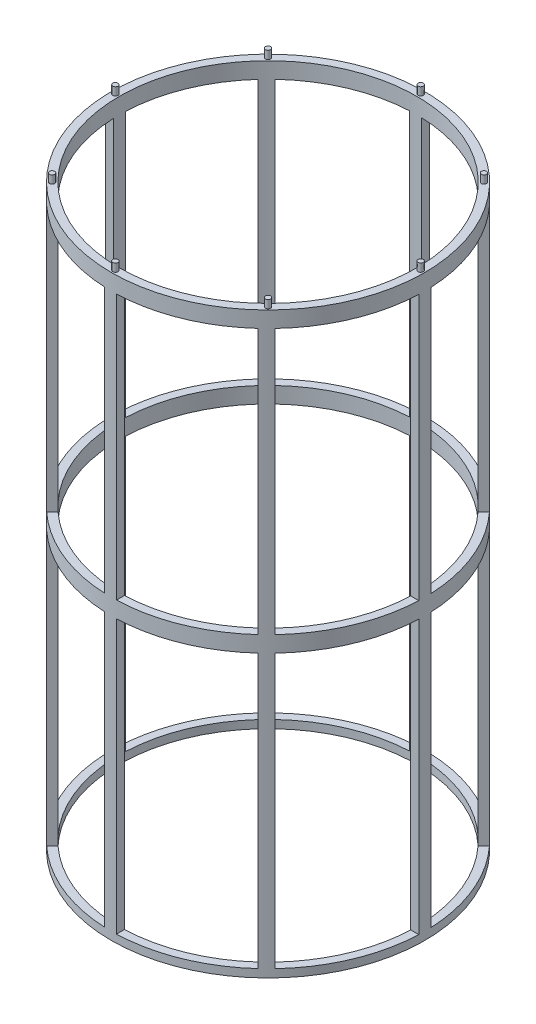
from build123d import *

# Parameters (mm, degrees)
SKETCH1_R               = 49.53
SKETCH1_R_2             = 46.99
BOSS_EXTRUDE1_DEPTH     = 182.88
CUT_EXTRUDE1_DEPTH      = 177.8
SKETCH3_R               = 49.53
SKETCH3_R_2             = 46.99
BOSS_EXTRUDE2_DEPTH     = 2.54
SKETCH4_R               = 49.53
SKETCH4_R_2             = 46.99
BOSS_EXTRUDE3_DEPTH     = 2.54
BOSS_EXTRUDE4_START     = -5.08
SKETCH5_R               = 49.53
BOSS_EXTRUDE4_DEPTH     = 5.08
SKETCH6_W               = 50.419
SKETCH6_H               = 4.699
BOSS_EXTRUDE5_DEPTH     = 2.54
SKETCH7_R               = 0.8255
BOSS_EXTRUDE6_DEPTH     = 2.54
CIRPATTERN2_COUNT       = 8
CUT_EXTRUDE2_DEPTH      = 199.209531052
CUT_EXTRUDE2_DEPTH_BACK = 199.209531052
SKETCH8_W               = 132.398464635
SKETCH8_H               = 191.049097361


with BuildPart() as part:
    # Sketch1 → Boss-Extrude1 (new, symmetric)
    with BuildSketch(Plane(origin=(0, 0, 0), x_dir=(1, 0, 0), z_dir=(0, 1, 0))):
        with Locations(Location((0, 0, 0), (0, 0, 270))):
            Circle(SKETCH1_R)
        with Locations(Location((0, 0, 0), (0, 0, 270))):
            Circle(SKETCH1_R_2, mode=Mode.SUBTRACT)
    extrude(amount=BOSS_EXTRUDE1_DEPTH, both=True)

    # Sketch2 → Cut-Extrude1 (cut, symmetric)
    with BuildSketch(Plane(origin=(0, 0, 0), x_dir=(1, 0, 0), z_dir=(0, 1, 0))):
        with BuildLine():
            Line((34.339077963, -32.07628134), (36.13611782, -33.873321197))
            ThreePointArc((36.13611782, -33.873321197), (45.710930003, -19.071753413), (49.49527883, -1.854258207))
            Line((49.49527883, -1.854258207), (46.953400585, -1.854258207))
            ThreePointArc((46.953400585, -1.854258207), (43.364264524, -18.099742051), (34.339077963, -32.07628134))
        make_face()
        with BuildLine():
            ThreePointArc((1.584890151, -49.504636381), (18.664975227, -45.878530924), (33.425440685, -36.550797734))
            Line((33.425440685, -36.550797734), (31.627502039, -34.752859088))
            ThreePointArc((31.627502039, -34.752859088), (17.692915235, -43.531837205), (1.584890151, -46.963264614))
            Line((1.584890151, -46.963264614), (1.584890151, -49.504636381))
        make_face()
        with BuildLine():
            ThreePointArc((-33.543952964, -36.442065248), (-19.03558139, -45.726005086), (-2.225109849, -49.479993797))
            Line((-2.225109849, -49.479993797), (-2.225109849, -46.937287801))
            ThreePointArc((-2.225109849, -46.937287801), (-18.063572268, -43.379343666), (-31.746279167, -34.644391451))
            Line((-31.746279167, -34.644391451), (-33.543952964, -36.442065248))
        make_face()
        with BuildLine():
            Line((46.949282998, 1.955741793), (49.491372723, 1.955741793))
            ThreePointArc((49.491372723, 1.955741793), (45.777644234, 18.911059948), (36.442065248, 33.543952964))
            Line((36.442065248, 33.543952964), (34.644391451, 31.746279167))
            ThreePointArc((34.644391451, 31.746279167), (43.430990742, 17.93903964), (46.949282998, 1.955741793))
        make_face()
        with BuildLine():
            ThreePointArc((-49.49527883, -1.854258207), (-45.741824116, -18.997537381), (-36.245883162, -33.755841773))
            Line((-36.245883162, -33.755841773), (-34.448634556, -31.958593167))
            ThreePointArc((-34.448634556, -31.958593167), (-43.39516767, -18.025524205), (-46.953400585, -1.854258207))
            Line((-46.953400585, -1.854258207), (-49.49527883, -1.854258207))
        make_face()
        with BuildLine():
            Line((31.958593167, 34.448634556), (33.755841773, 36.245883162))
            ThreePointArc((33.755841773, 36.245883162), (18.873008967, 45.79334485), (1.584890151, 49.504636381))
            Line((1.584890151, 49.504636381), (1.584890151, 46.963264614))
            ThreePointArc((1.584890151, 46.963264614), (17.900986276, 43.446689061), (31.958593167, 34.448634556))
        make_face()
        with BuildLine():
            ThreePointArc((-36.550797734, 33.425440685), (-45.80828813, 18.836709868), (-49.491372723, 1.955741793))
            Line((-49.491372723, 1.955741793), (-46.949282998, 1.955741793))
            ThreePointArc((-46.949282998, 1.955741793), (-43.461630715, 17.864678995), (-34.752859088, 31.627502039))
            Line((-34.752859088, 31.627502039), (-36.550797734, 33.425440685))
        make_face()
        with BuildLine():
            Line((-2.225109849, 46.937287801), (-2.225109849, 49.479993797))
            ThreePointArc((-2.225109849, 49.479993797), (-19.242893169, 45.63914945), (-33.873321197, 36.13611782))
            Line((-33.873321197, 36.13611782), (-32.07628134, 34.339077963))
            ThreePointArc((-32.07628134, 34.339077963), (-18.270880717, 43.292436035), (-2.225109849, 46.937287801))
        make_face()
    extrude(amount=CUT_EXTRUDE1_DEPTH, both=True, mode=Mode.SUBTRACT)

    # Sketch3 → Boss-Extrude2 (add, symmetric)
    with BuildSketch(Plane(origin=(0, 91.44, 0), x_dir=(1, 0, 0), z_dir=(0, 1, 0))):
        with Locations(Location((0, 0, 0), (0, 0, 270))):
            Circle(SKETCH3_R)
        with Locations(Location((0, 0, 0), (0, 0, 270))):
            Circle(SKETCH3_R_2, mode=Mode.SUBTRACT)
    boss_extrude2 = extrude(amount=BOSS_EXTRUDE2_DEPTH, both=True)

    # Mirror1: Boss-Extrude2 across plane
    add(boss_extrude2.mirror(Plane.ZX))

    # Sketch4 → Boss-Extrude3 (add, symmetric)
    with BuildSketch(Plane(origin=(0, 0, 0), x_dir=(1, 0, 0), z_dir=(0, 1, 0))):
        with Locations(Location((0, 0, 0), (0, 0, 270))):
            Circle(SKETCH4_R)
        with Locations(Location((0, 0, 0), (0, 0, 270))):
            Circle(SKETCH4_R_2, mode=Mode.SUBTRACT)
    extrude(amount=BOSS_EXTRUDE3_DEPTH, both=True)

    # Sketch5 → Boss-Extrude4 (add)
    with BuildSketch(Plane.XZ.offset(182.88).offset(BOSS_EXTRUDE4_START)):
        with Locations(Location((0, 0, 0), (0, 0, 90))):
            Circle(SKETCH5_R)
    extrude(amount=BOSS_EXTRUDE4_DEPTH)

    # Sketch6 → Boss-Extrude5 (add)
    with BuildSketch(Plane(origin=(0, -177.8, 0), x_dir=(1, 0, 0), z_dir=(0, 1, 0))):
        Rectangle(SKETCH6_W, SKETCH6_H)
    extrude(amount=BOSS_EXTRUDE5_DEPTH)

    # Sketch7 → Boss-Extrude6 (add)
    with BuildSketch(Plane(origin=(0, 182.88, 0), x_dir=(1, 0, 0), z_dir=(0, 1, 0))):
        with Locations(Location((48.26, 0, 0), (0, 0, 270))):
            Circle(SKETCH7_R)
    boss_extrude6 = extrude(amount=BOSS_EXTRUDE6_DEPTH)

    # CirPattern2: Boss-Extrude6 ×8 about axis
    cirpattern2_axis = Axis((0, 0, 0), (0, 1, 0))
    for i in range(1, CIRPATTERN2_COUNT):
        add(boss_extrude6.rotate(cirpattern2_axis, i * 360 / CIRPATTERN2_COUNT))

    # Sketch8 → Cut-Extrude2 (cut, two sides: drawn at the far end of the back side and taken through both)
    with BuildSketch(Plane(origin=(0, 0, 0), x_dir=(0, 0, -1), z_dir=(1, 0, 0)).offset(-CUT_EXTRUDE2_DEPTH_BACK)):
        with Locations((2.481127426, -95.524548681)):
            Rectangle(SKETCH8_W, SKETCH8_H)
    extrude(amount=CUT_EXTRUDE2_DEPTH + CUT_EXTRUDE2_DEPTH_BACK, mode=Mode.SUBTRACT)


solid = part.part
